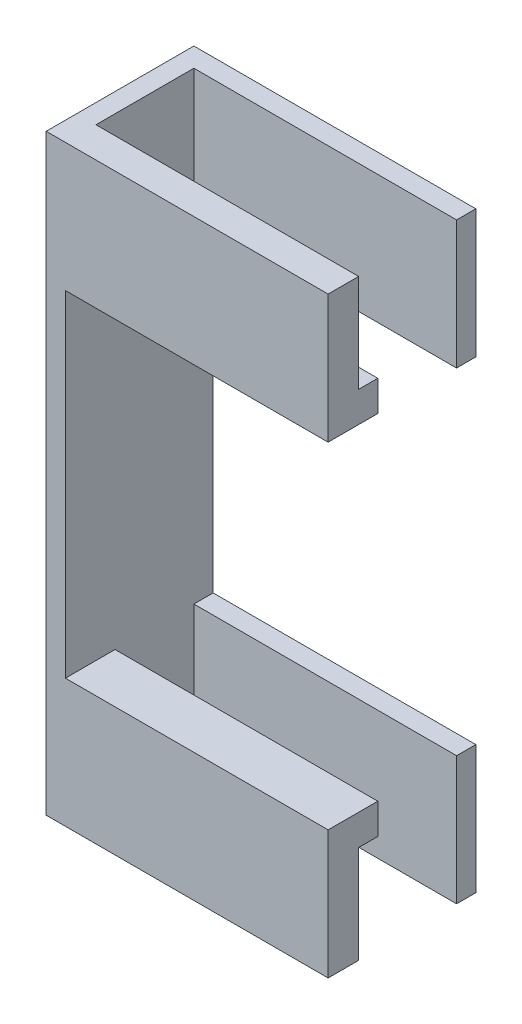
from build123d import *

# Parameters (mm, degrees)
BOSS_EXTRUDE2_DEPTH   = 21.844
BOSS_EXTRUDE2_2_DEPTH = 21.844
SKETCH3_W             = 4.1275
SKETCH3_H             = 39.7002
BOSS_EXTRUDE3_DEPTH   = 1.6002
SKETCH4_W             = 1.6002
SKETCH4_H             = 39.7002
BOSS_EXTRUDE4_DEPTH   = 6.5532
SKETCH5_W             = 23.4442
SKETCH5_H             = 39.7002
BOSS_EXTRUDE5_DEPTH   = 1.6002
BOSS_EXTRUDE6_DEPTH   = 4.7752
SKETCH7_W             = 21.844
SKETCH7_H             = 27.9146
CUT_EXTRUDE1_DEPTH    = 6.35


with BuildPart() as part:
    # Sketch2 → Boss-Extrude2 (new body)
    with BuildSketch(Plane(origin=(0, 0, 0), x_dir=(0, 0, -1), z_dir=(1, 0, 0))):
        Polygon((-8.001, 19.8501), (-8.001, 16.4973), (-6.4135, 16.4973), (-6.4135, 13.9573), (-10.541, 13.9573), (-10.541, 19.8501), align=None)
    extrude(amount=BOSS_EXTRUDE2_DEPTH)



with BuildPart() as body_2:
    # Sketch2 → Boss-Extrude2 2 (new body)
    with BuildSketch(Plane(origin=(0, 0, 0), x_dir=(0, 0, -1), z_dir=(1, 0, 0))):
        Polygon((-6.4135, -16.4973), (-6.4135, -13.9573), (-10.541, -13.9573), (-10.541, -19.8501), (-8.001, -19.8501), (-8.001, -16.4973), align=None)
    extrude(amount=BOSS_EXTRUDE2_2_DEPTH)


with BuildPart() as part_1:
    add(part.part)

    add(body_2.part)  # Boss-Extrude3 merges body 2
    # Sketch3 → Boss-Extrude3 (add)
    with BuildSketch(Plane.ZY):
        with Locations((8.47725, 0)):
            Rectangle(SKETCH3_W, SKETCH3_H)
    extrude(amount=BOSS_EXTRUDE3_DEPTH)

    # Sketch4 → Boss-Extrude4 (add)
    with BuildSketch(Plane(origin=(0, 0, 6.4135), x_dir=(-1, 0, 0), z_dir=(0, 0, -1))):
        with Locations((0.8001, 0)):
            Rectangle(SKETCH4_W, SKETCH4_H)
    extrude(amount=BOSS_EXTRUDE4_DEPTH)

    # Sketch5 → Boss-Extrude5 (add)
    with BuildSketch(Plane(origin=(0, 0, -0.1397), x_dir=(-1, 0, 0), z_dir=(0, 0, -1))):
        with Locations((-10.1219, 0)):
            Rectangle(SKETCH5_W, SKETCH5_H)
    extrude(amount=BOSS_EXTRUDE5_DEPTH)

    # Sketch6 → Boss-Extrude6 (add)
    with BuildSketch(Plane(origin=(0, 19.8501, 0), x_dir=(1, 0, 0), z_dir=(0, 1, 0))):
        Polygon((21.844, -8.001), (0, -8.001), (0, 0.1397), (21.844, 0.1397), (21.844, 1.7399), (-1.6002, 1.7399), (-1.6002, -10.541), (21.844, -10.541), align=None)
    boss_extrude6 = extrude(amount=BOSS_EXTRUDE6_DEPTH)

    # Mirror1: Boss-Extrude6 across plane
    add(boss_extrude6.mirror(Plane.ZX))

    # Sketch7 → Cut-Extrude1 (cut)
    with BuildSketch(Plane.XY.offset(-0.1397)):
        with Locations((10.922, 0)):
            Rectangle(SKETCH7_W, SKETCH7_H)
    extrude(amount=-CUT_EXTRUDE1_DEPTH, mode=Mode.SUBTRACT)


solid = part_1.part
